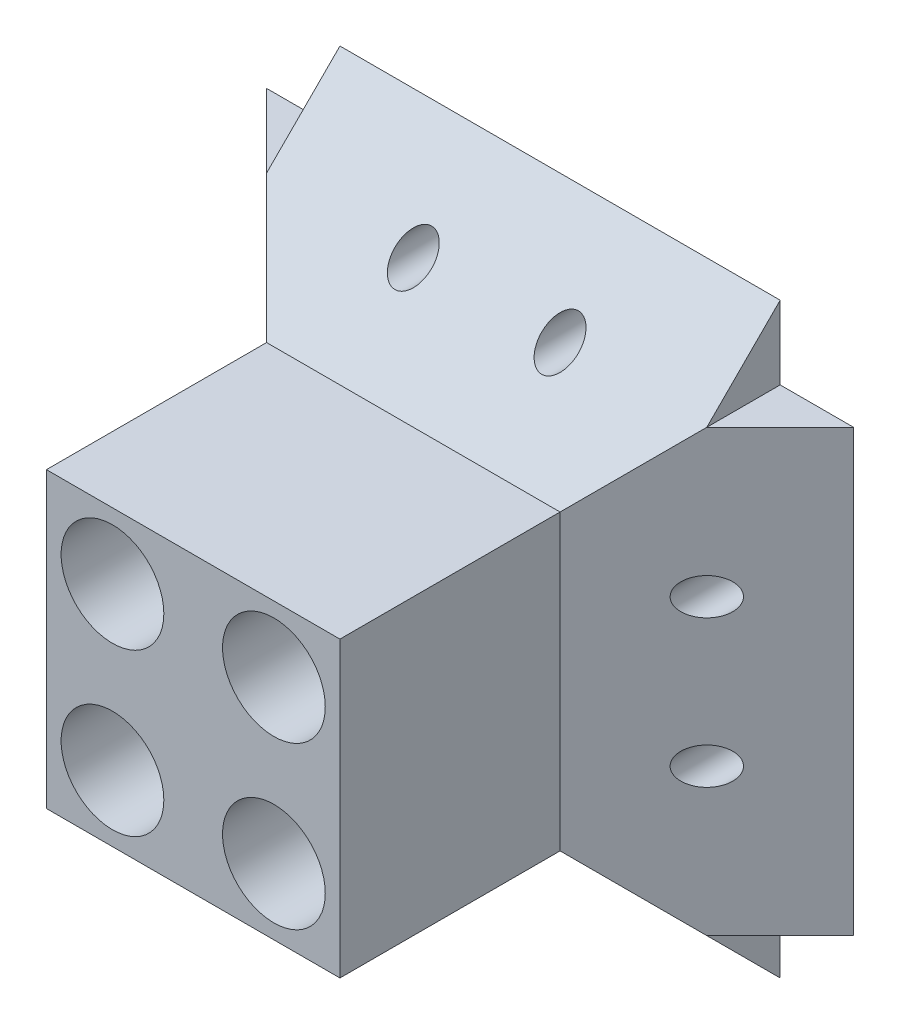
from build123d import *

# Parameters (mm, degrees)
SKETCH_1_W                = 20
SKETCH_1_H                = 20
EXTRUDE_1_DEPTH           = 40
SKETCH_2_W                = 10
SKETCH_2_H                = 15
CUT_EXTRUDE_1_DEPTH       = 7.071067812
PATTERN_CIRCULAR_1_COUNT  = 4
SKETCH_5_R                = 3.5
CUT_EXTRUDE_2_DEPTH       = 25
CUT_EXTRUDE_3_DEPTH       = 5
SKETCH_9_W                = 5.878932188
SKETCH_9_H                = 5.878932188
CUT_EXTRUDE_5_DEPTH       = 5
SKETCH_11_W               = 10
SKETCH_11_H               = 30
EXTRUDE_2_DEPTH           = 10
CUT_EXTRUDE_6_DEPTH       = 30
SKETCH_13_R               = 1.25
CUT_EXTRUDE_7_DEPTH       = 10
PATTERN_CIRCULAR_2_COUNT  = 4
SKETCH_16_W               = 20
SKETCH_16_H               = 10
CUT_EXTRUDE_11_DEPTH      = 40
SKETCH_17_W               = 20
SKETCH_17_H               = 20
SKETCH_17_W_2             = 5.857864376
SKETCH_17_H_2             = 5.857864376
CUT_EXTRUDE_12_DEPTH      = 5
CUT_EXTRUDE_13_DEPTH      = 54.851648071
CUT_EXTRUDE_13_DEPTH_BACK = 10


with BuildPart() as part:
    # 스케치1 → 보스-돌출1 (new body)
    with BuildSketch(Plane.XY):
        Rectangle(SKETCH_1_W, SKETCH_1_H)
    extrude(amount=EXTRUDE_1_DEPTH)

    # 스케치2 → 컷-돌출1 (cut)
    with BuildSketch(Plane(origin=(10, 0, 0), x_dir=(0, 0, -1), z_dir=(1, 0, 0))):
        with Locations((-10, 0)):
            Rectangle(SKETCH_2_W, SKETCH_2_H)
    cut_extrude_1 = extrude(amount=-CUT_EXTRUDE_1_DEPTH, mode=Mode.SUBTRACT)

    # 원형 패턴1: 컷-돌출1 ×4 about axis
    pattern_circular_1_axis = Axis((0, 0, 0), (0, 0, 1))
    for i in range(1, PATTERN_CIRCULAR_1_COUNT):
        add(cut_extrude_1.rotate(pattern_circular_1_axis, i * 360 / PATTERN_CIRCULAR_1_COUNT), mode=Mode.SUBTRACT)

    # 스케치5 → 컷-돌출2 (cut)
    with BuildSketch(Plane.XY.offset(40)):
        with Locations((-5.5, 5.5)):
            Circle(SKETCH_5_R)
        with Locations((5.5, 5.5)):
            Circle(SKETCH_5_R)
        with Locations(Location((-5.5, -5.5, 0), (0, 0, 235.150095421))):
            Circle(SKETCH_5_R)
        with Locations(Location((5.5, -5.5, 0), (0, 0, 304.849904579))):
            Circle(SKETCH_5_R)
    extrude(amount=-CUT_EXTRUDE_2_DEPTH, mode=Mode.SUBTRACT)

    # 스케치6 → 컷-돌출3 (cut)
    with BuildSketch(Plane(origin=(0, 0, 0), x_dir=(-1, 0, 0), z_dir=(0, 0, -1))):
        Polygon((-14.808802863, -2.95), (-14.808802863, 2.95), (-2.95, 2.95), (-2.95, 12.360254216), (2.95, 12.360254216), (2.95, 2.95), (13.852115441, 2.95), (13.852115441, -2.95), (2.95, -2.95), (2.95, -13.975695818), (-2.95, -13.975695818), (-2.95, -2.95), align=None)
    extrude(amount=-CUT_EXTRUDE_3_DEPTH, mode=Mode.SUBTRACT)

    # 스케치9 → 컷-돌출5 (cut)
    with BuildSketch(Plane(origin=(0, 0, 5), x_dir=(-1, 0, 0), z_dir=(0, 0, -1))):
        with Locations((0.010533906, -0.010533906)):
            Rectangle(SKETCH_9_W, SKETCH_9_H)
    extrude(amount=-CUT_EXTRUDE_5_DEPTH, mode=Mode.SUBTRACT)

    # 스케치11 → 보스-돌출2 (add)
    with BuildSketch(Plane(origin=(10, 0, 0), x_dir=(0, 0, -1), z_dir=(1, 0, 0))):
        with Locations((-20, 0)):
            Rectangle(SKETCH_11_W, SKETCH_11_H)
    extrude_2 = extrude(amount=EXTRUDE_2_DEPTH)

    # 스케치12 → 컷-돌출6 (cut)
    with BuildSketch(Plane(origin=(0, 15, 0), x_dir=(1, 0, 0), z_dir=(0, 1, 0))):
        Polygon((20, -15), (10, -25), (20, -25), align=None)
    cut_extrude_6 = extrude(amount=-CUT_EXTRUDE_6_DEPTH, mode=Mode.SUBTRACT)

    # 스케치13 → 컷-돌출7 (cut)
    with BuildSketch(Plane(origin=(0, 0, 15), x_dir=(-1, 0, 0), z_dir=(0, 0, -1))):
        with Locations(Location((-15, -5, 0), (0, 0, 90))):
            Circle(SKETCH_13_R)
        with Locations(Location((-15, 5, 0), (0, 0, 90))):
            Circle(SKETCH_13_R)
    cut_extrude_7 = extrude(amount=-CUT_EXTRUDE_7_DEPTH, mode=Mode.SUBTRACT)

    # 원형 패턴2: 보스-돌출2, 컷-돌출6, 컷-돌출7 ×4 about axis
    pattern_circular_2_axis = Axis((0, 0, 0), (0, 0, 1))
    add([extrude_2.rotate(pattern_circular_2_axis, i * 360 / PATTERN_CIRCULAR_2_COUNT) for i in range(1, PATTERN_CIRCULAR_2_COUNT)])
    add([cut_extrude_6.rotate(pattern_circular_2_axis, i * 360 / PATTERN_CIRCULAR_2_COUNT) for i in range(1, PATTERN_CIRCULAR_2_COUNT)], mode=Mode.SUBTRACT)
    add([cut_extrude_7.rotate(pattern_circular_2_axis, i * 360 / PATTERN_CIRCULAR_2_COUNT) for i in range(1, PATTERN_CIRCULAR_2_COUNT)], mode=Mode.SUBTRACT)

    # 스케치16 → 컷-돌출11 (cut)
    with BuildSketch(Plane.XZ.offset(10)):
        with Locations((0, 5)):
            Rectangle(SKETCH_16_W, SKETCH_16_H)
    extrude(amount=-CUT_EXTRUDE_11_DEPTH, mode=Mode.SUBTRACT)

    # 스케치17 → 컷-돌출12 (cut)
    with BuildSketch(Plane(origin=(0, 0, 10), x_dir=(-1, 0, 0), z_dir=(0, 0, -1))):
        Rectangle(SKETCH_17_W, SKETCH_17_H)
        Rectangle(SKETCH_17_W_2, SKETCH_17_H_2, mode=Mode.SUBTRACT)
    extrude(amount=-CUT_EXTRUDE_12_DEPTH, mode=Mode.SUBTRACT)

    # 스케치18 → 컷-돌출13 (cut, two sides: drawn at the far end of the back side and taken through both)
    with BuildSketch(Plane.XZ.offset(-10).offset(-CUT_EXTRUDE_13_DEPTH_BACK)):
        Polygon((10, 25), (15, 25), (15, 20), align=None)
    extrude(amount=CUT_EXTRUDE_13_DEPTH + CUT_EXTRUDE_13_DEPTH_BACK, mode=Mode.SUBTRACT)


solid = part.part
